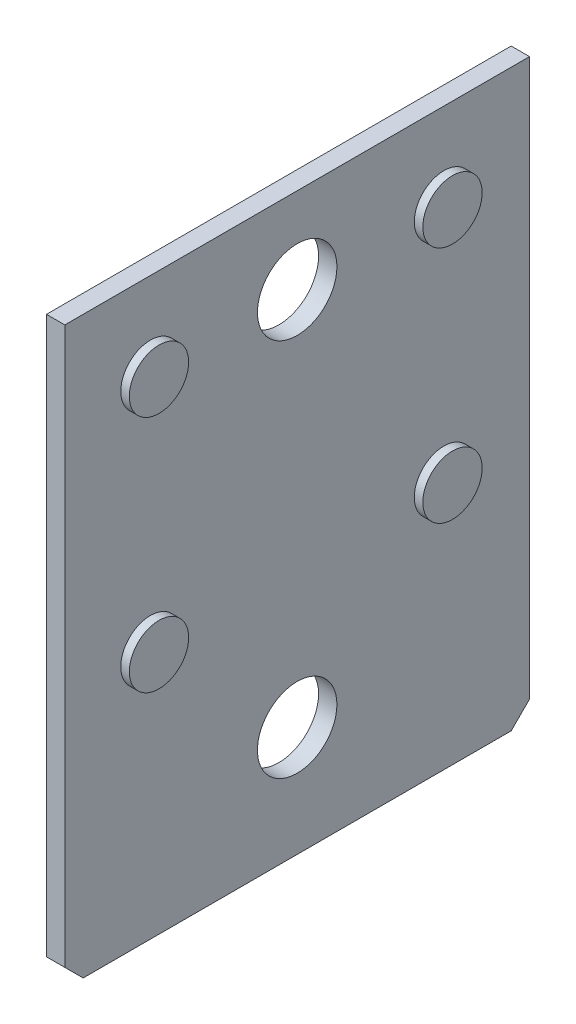
from build123d import *

# Parameters (mm, degrees)
SKETCH1_W           = 38
SKETCH1_H           = 47
BOSS_EXTRUDE1_DEPTH = 1.5
SKETCH2_R           = 3.25
CUT_EXTRUDE1_DEPTH  = 51.717354032
SKETCH3_R           = 2.425
CUT_EXTRUDE2_DEPTH  = 0.7
SKETCH4_R           = 2.425
BOSS_EXTRUDE2_DEPTH = 0.7
CHAMFER1_SIZE       = 1.5


with BuildPart() as part:
    # Sketch1 → Boss-Extrude1 (new body)
    with BuildSketch(Plane(origin=(0, 0, 0), x_dir=(0, 0, -1), z_dir=(1, 0, 0))):
        with Locations((0, 23.5)):
            Rectangle(SKETCH1_W, SKETCH1_H)
    extrude(amount=BOSS_EXTRUDE1_DEPTH)

    # Sketch2 → Cut-Extrude1 (cut, through all)
    with BuildSketch(Plane(origin=(1.5, 0, 0), x_dir=(0, 0, -1), z_dir=(1, 0, 0))):
        with Locations((0, 9)):
            Circle(SKETCH2_R)
        with Locations((0, 40)):
            Circle(SKETCH2_R)
    extrude(amount=-CUT_EXTRUDE1_DEPTH, mode=Mode.SUBTRACT)

    # Sketch3 → Cut-Extrude2 (cut)
    with BuildSketch(Plane.ZY):
        with Locations((-12, 40)):
            Circle(SKETCH3_R)
        with Locations((12, 40)):
            Circle(SKETCH3_R)
        with Locations((-12, 20.5)):
            Circle(SKETCH3_R)
        with Locations((12, 20.5)):
            Circle(SKETCH3_R)
    extrude(amount=-CUT_EXTRUDE2_DEPTH, mode=Mode.SUBTRACT)

    # Sketch4 → Boss-Extrude2 (add)
    with BuildSketch(Plane(origin=(1.5, 0, 0), x_dir=(0, 0, -1), z_dir=(1, 0, 0))):
        with Locations(Location((-12, 40, 0), (0, 0, 180))):
            Circle(SKETCH4_R)
        with Locations(Location((12, 40, 0), (0, 0, 180))):
            Circle(SKETCH4_R)
        with Locations(Location((-12, 20.5, 0), (0, 0, 180))):
            Circle(SKETCH4_R)
        with Locations(Location((12, 20.5, 0), (0, 0, 180))):
            Circle(SKETCH4_R)
    extrude(amount=BOSS_EXTRUDE2_DEPTH)

    # Chamfer1
    chamfer1_edges = [part.edges().sort_by_distance(p)[0] for p in [
        (0.75, 0, -19),
        (0.75, 0, 19),
    ]]
    chamfer(chamfer1_edges, length=CHAMFER1_SIZE)


solid = part.part
